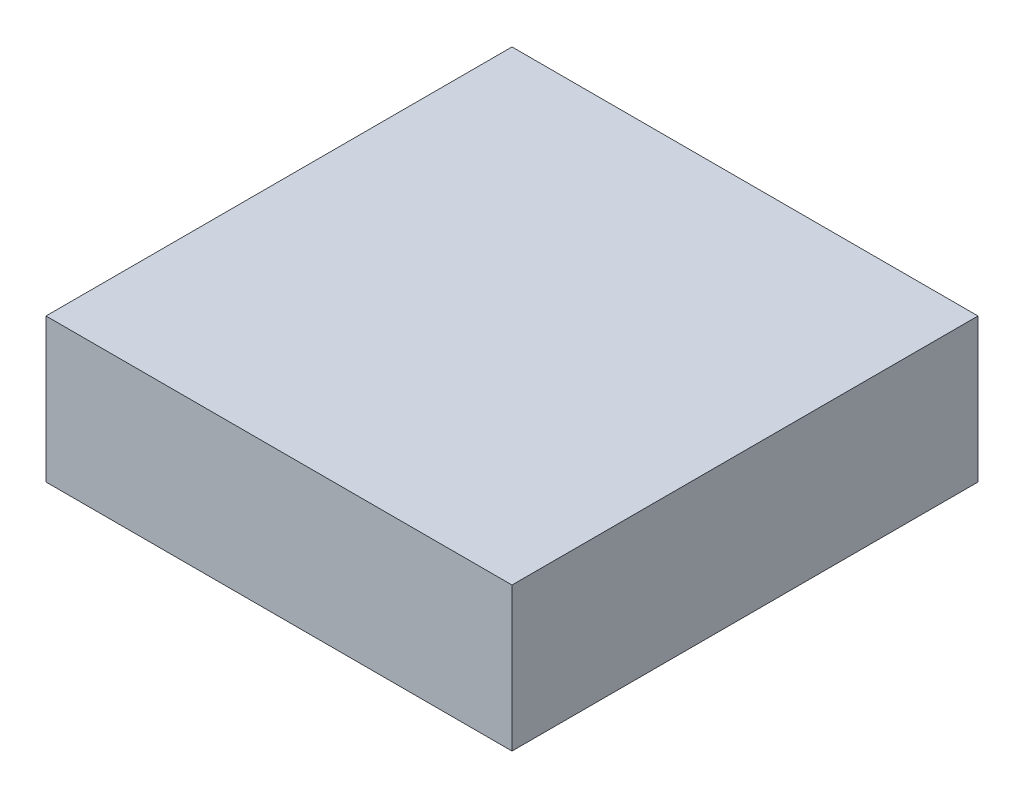
from build123d import *

# Parameters (mm, degrees)
SKETCH1_W           = 64.8
SKETCH1_H           = 64.8
BOSS_EXTRUDE1_DEPTH = 20


with BuildPart() as part:
    # Sketch1 → Boss-Extrude1 (new body)
    with BuildSketch(Plane(origin=(0, 0, 0), x_dir=(1, 0, 0), z_dir=(0, 1, 0))):
        Rectangle(SKETCH1_W, SKETCH1_H)
    extrude(amount=BOSS_EXTRUDE1_DEPTH)


solid = part.part
